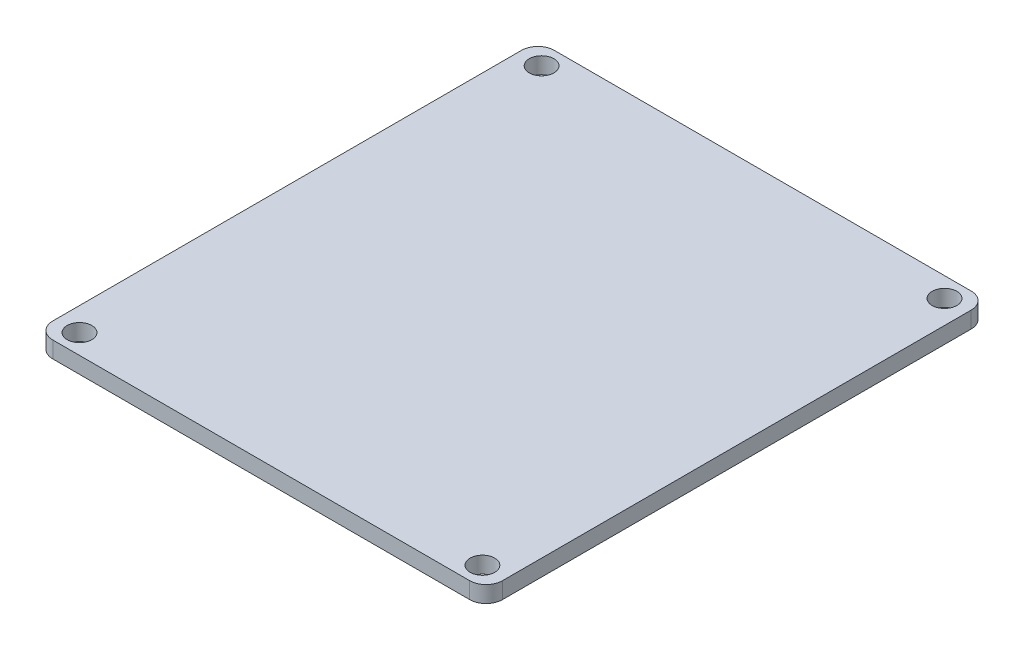
from build123d import *

# Parameters (mm, degrees)
SKETCH_1_W      = 54.7
SKETCH_1_H      = 61
SKETCH_1_R      = 1.5
EXTRUDE_1_DEPTH = 2
FILLET_1_R      = 2


with BuildPart() as part:
    # 草图1 → 凸台-拉伸1 (new body)
    with BuildSketch(Plane(origin=(0, 0, 0), x_dir=(1, 0, 0), z_dir=(0, 1, 0))):
        Rectangle(SKETCH_1_W, SKETCH_1_H)
        with Locations(Location((-24.5, 28.1, 0), (0, 0, 270))):
            Circle(SKETCH_1_R, mode=Mode.SUBTRACT)
        with Locations(Location((-24.5, -28.1, 0), (0, 0, 90))):
            Circle(SKETCH_1_R, mode=Mode.SUBTRACT)
        with Locations(Location((24.5, 28.1, 0), (0, 0, 90))):
            Circle(SKETCH_1_R, mode=Mode.SUBTRACT)
        with Locations(Location((24.5, -28.1, 0), (0, 0, 270))):
            Circle(SKETCH_1_R, mode=Mode.SUBTRACT)
    extrude(amount=EXTRUDE_1_DEPTH)

    # 圆角1
    fillet_1_edges = [part.edges().sort_by_distance(p)[0] for p in [
        (27.35, 1, 30.5),
        (-27.35, 1, 30.5),
        (-27.35, 1, -30.5),
        (27.35, 1, -30.5),
    ]]
    fillet(fillet_1_edges, radius=FILLET_1_R)


solid = part.part
